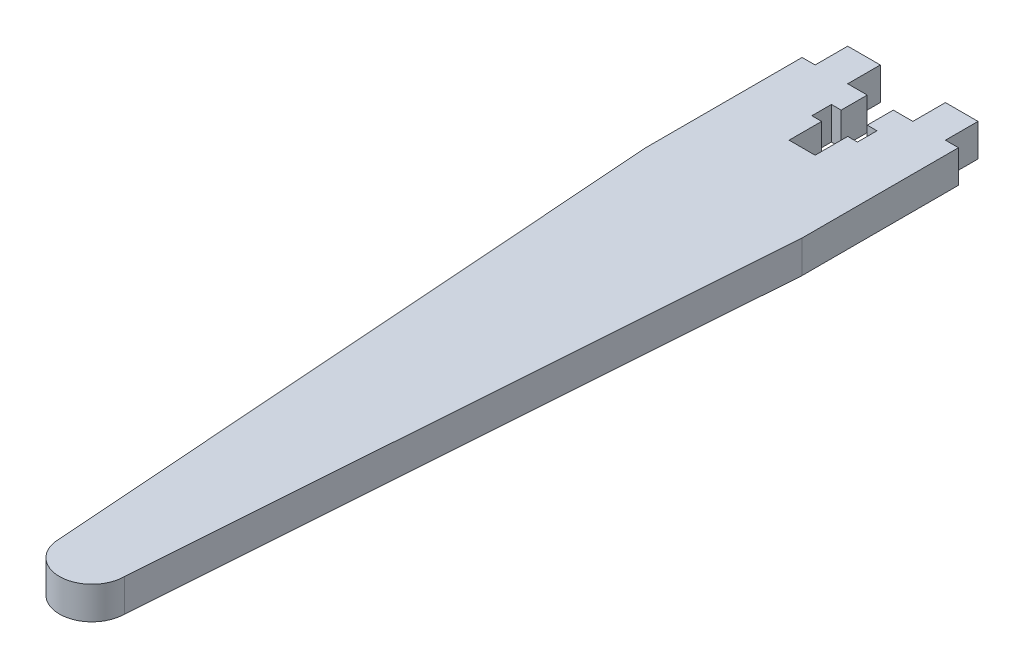
from build123d import *

# Parameters (mm, degrees)
BOSS_EXTRUDE1_DEPTH = 5


with BuildPart() as part:
    # Sketch1 → Boss-Extrude1 (new body)
    with BuildSketch(Plane(origin=(0, 0, 0), x_dir=(1, 0, 0), z_dir=(0, 1, 0))):
        with BuildLine():
            Line((0, 0), (0, 24))
            Line((0, 24), (2, 24))
            Line((2, 24), (2, 29))
            Line((2, 29), (7, 29))
            Line((7, 29), (7, 24))
            Line((7, 24), (10, 24))
            Line((10, 24), (10, 20))
            Line((10, 20), (8.5, 20))
            Line((8.5, 20), (8.5, 17))
            Line((8.5, 17), (10, 17))
            Line((10, 17), (10, 12))
            Line((10, 12), (14, 12))
            Line((14, 12), (14, 17))
            Line((14, 17), (15.5, 17))
            Line((15.5, 17), (15.5, 20))
            Line((15.5, 20), (14, 20))
            Line((14, 20), (14, 24))
            Line((14, 24), (17, 24))
            Line((17, 24), (17, 29))
            Line((17, 29), (22, 29))
            Line((22, 29), (22, 24))
            Line((22, 24), (24, 24))
            Line((24, 24), (24, 0))
            Line((24, 0), (17, -97))
            ThreePointArc((17, -97), (12, -102), (7, -97))
            Line((7, -97), (0, 0))
        make_face()
    extrude(amount=BOSS_EXTRUDE1_DEPTH)


solid = part.part
